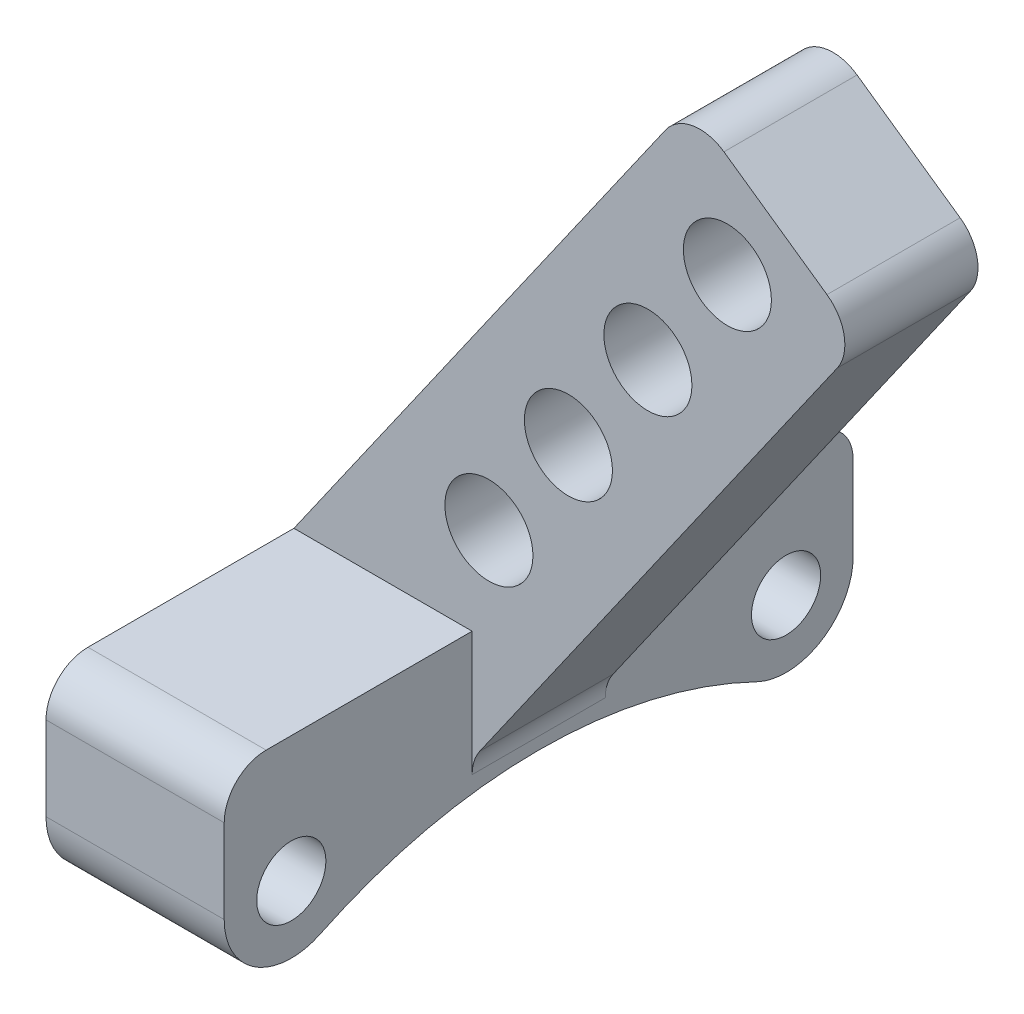
from build123d import *

# Parameters (mm, degrees)
SKETCH1_R           = 1.65
BOSS_EXTRUDE1_DEPTH = 8.5
SKETCH2_R           = 2.1
BOSS_EXTRUDE2_DEPTH = 3.175
FILLET1_R           = 2
CUT_EXTRUDE1_START  = -10
CUT_EXTRUDE1_DEPTH  = 10


with BuildPart() as part:
    # Sketch1 → Boss-Extrude1 (new body)
    with BuildSketch(Plane(origin=(0, 0, 0), x_dir=(0, 0, -1), z_dir=(1, 0, 0))):
        with BuildLine():
            Line((-13, -6), (13, -6))
            ThreePointArc((13, -6), (14.414213562, -5.414213562), (15, -4))
            Line((15, -4), (15, 4))
            ThreePointArc((15, 4), (14.414213562, 5.414213562), (13, 6))
            Line((13, 6), (-13, 6))
            ThreePointArc((-13, 6), (-14.414213562, 5.414213562), (-15, 4))
            Line((-15, 4), (-15, -4))
            ThreePointArc((-15, -4), (-14.414213562, -5.414213562), (-13, -6))
        make_face()
        with Locations((-11.8, 0)):
            Circle(SKETCH1_R, mode=Mode.SUBTRACT)
        with Locations((11.8, 0)):
            Circle(SKETCH1_R, mode=Mode.SUBTRACT)
    extrude(amount=BOSS_EXTRUDE1_DEPTH)

    # Sketch2 → Boss-Extrude2 (add, symmetric)
    with BuildSketch(Plane.XY):
        with BuildLine():
            Line((25.918129472, 25.580456988), (3.805255429, -6))
            Line((3.805255429, -6), (0, -3.335531464))
            Line((0, -3.335531464), (0, 6))
            Line((0, 6), (17.726609029, 31.316221351))
            ThreePointArc((17.726609029, 31.316221351), (19.017616762, 32.138683985), (20.51206599, 31.807372567))
            Line((20.51206599, 31.807372567), (25.426978256, 28.365913949))
            ThreePointArc((25.426978256, 28.365913949), (26.249440889, 27.074906216), (25.918129472, 25.580456988))
        make_face()
        with Locations((20.675216378, 26.810035081)):
            Circle(SKETCH2_R, mode=Mode.SUBTRACT)
        with Locations((16.883876134, 21.395440068)):
            Circle(SKETCH2_R, mode=Mode.SUBTRACT)
        with Locations((13.092535889, 15.980845055)):
            Circle(SKETCH2_R, mode=Mode.SUBTRACT)
        with Locations((9.301195645, 10.566250043)):
            Circle(SKETCH2_R, mode=Mode.SUBTRACT)
    extrude(amount=BOSS_EXTRUDE2_DEPTH, both=True)

    # Fillet1
    fillet1_edges = [part.edges().sort_by_distance(p)[0] for p in [
        (8.5, 0.704790101, 0),
    ]]
    fillet(fillet1_edges, radius=FILLET1_R)

    # Sketch4 → Cut-Extrude1 (cut)
    with BuildSketch(Plane(origin=(8.5, 0, 0), x_dir=(0, 0, -1), z_dir=(1, 0, 0)).offset(CUT_EXTRUDE1_START)):
        with BuildLine():
            Line((-15, 0), (-15, -4))
            ThreePointArc((-15, -4), (-14.414213562, -5.414213562), (-13, -6))
            Line((-13, -6), (13, -6))
            ThreePointArc((13, -6), (14.414213562, -5.414213562), (15, -4))
            Line((15, -4), (15, 0))
            ThreePointArc((15, 0), (13.501034406, -2.710439438), (10.408448782, -2.881594213))
            ThreePointArc((10.408448782, -2.881594213), (0, -0.5), (-10.408448782, -2.881594213))
            ThreePointArc((-10.408448782, -2.881594213), (-13.501034406, -2.710439438), (-15, 0))
        make_face()
    extrude(amount=CUT_EXTRUDE1_DEPTH, mode=Mode.SUBTRACT)


solid = part.part
